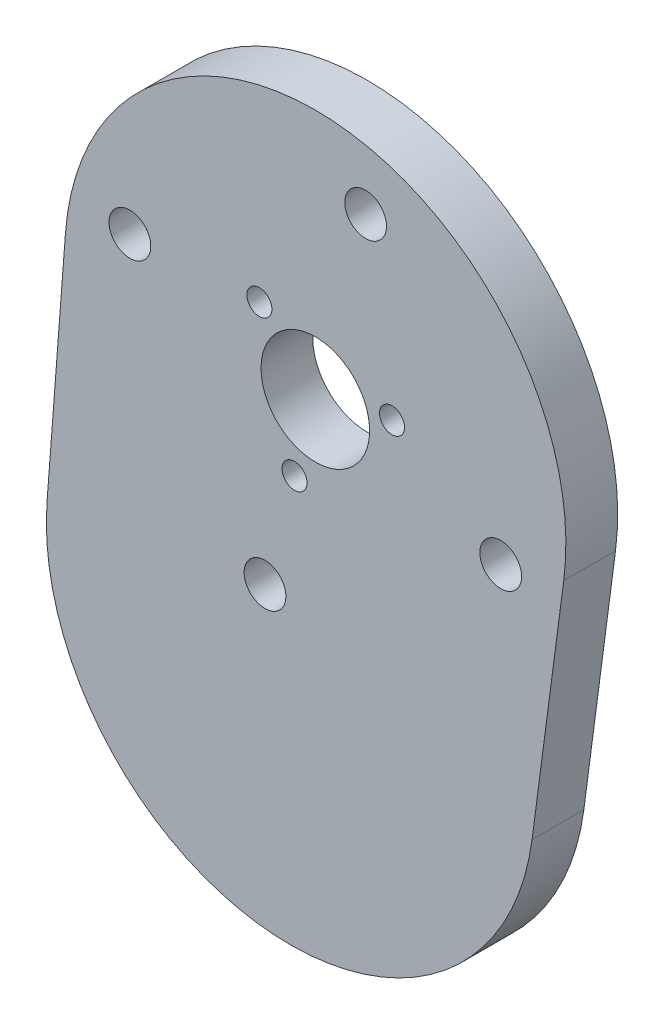
from build123d import *

# Parameters (mm, degrees)
SKETCH1_R           = 2.5
SKETCH1_R_2         = 6.5
BOSS_EXTRUDE1_DEPTH = 6.2
CUT_EXTRUDE1_REACH  = 68.667
SKETCH2_R           = 1.5


with BuildPart() as part:
    # Sketch1 → Boss-Extrude1 (new body)
    with BuildSketch(Plane.XY):
        with BuildLine():
            Line((25.948954725, -32.665145778), (29.742076772, -3.925413261))
            ThreePointArc((29.742076772, -3.925413261), (3.103448276, 29.839045038), (-29.913301505, 2.279121121))
            Line((-29.913301505, 2.279121121), (-32.115613465, -26.626065646))
            ThreePointArc((-32.115613465, -26.626065646), (-6.020689655, -57.887747374), (25.948954725, -32.665145778))
        make_face()
        with Locations(Location((22.196999252, -6.024385794, 0), (0, 0, 180))):
            Circle(SKETCH1_R, mode=Mode.SUBTRACT)
        with Locations(Location((-22.196999252, 6.024385794, 0), (0, 0, 180))):
            Circle(SKETCH1_R, mode=Mode.SUBTRACT)
        with Locations(Location((6.024385794, 22.196999252, 0), (0, 0, 180))):
            Circle(SKETCH1_R, mode=Mode.SUBTRACT)
        with Locations(Location((-6.024385794, -22.196999252, 0), (0, 0, 180))):
            Circle(SKETCH1_R, mode=Mode.SUBTRACT)
        with Locations(Location((0, 0, 0), (0, 0, 180))):
            Circle(SKETCH1_R_2, mode=Mode.SUBTRACT)
    extrude(amount=BOSS_EXTRUDE1_DEPTH)

    # Sketch2 → Cut-Extrude1 (cut, up to next)
    with BuildSketch(Plane.XY.offset(6.2), mode=Mode.PRIVATE) as cut_extrude1_sk1:
        with Locations((9.184169665, 2.42920307)):
            Circle(SKETCH2_R)
    cut_extrude1_tool1 = extrude(cut_extrude1_sk1.sketch, amount=-CUT_EXTRUDE1_REACH, mode=Mode.PRIVATE) & part.part
    # Sketch2 → Cut-Extrude1 (cut, up to next)
    with BuildSketch(Plane.XY.offset(6.2), mode=Mode.PRIVATE) as cut_extrude1_sk2:
        with Locations((-6.695836403, 6.739122708)):
            Circle(SKETCH2_R)
    cut_extrude1_tool2 = extrude(cut_extrude1_sk2.sketch, amount=-CUT_EXTRUDE1_REACH, mode=Mode.PRIVATE) & part.part
    # Sketch2 → Cut-Extrude1 (cut, up to next)
    with BuildSketch(Plane.XY.offset(6.2), mode=Mode.PRIVATE) as cut_extrude1_sk3:
        with Locations((-2.488333263, -9.168325778)):
            Circle(SKETCH2_R)
    cut_extrude1_tool3 = extrude(cut_extrude1_sk3.sketch, amount=-CUT_EXTRUDE1_REACH, mode=Mode.PRIVATE) & part.part
    add(cut_extrude1_tool1.solids().sort_by_distance((9.18417, 2.429203, 6.2))[0], mode=Mode.SUBTRACT)
    add(cut_extrude1_tool2.solids().sort_by_distance((-6.695836, 6.739123, 6.2))[0], mode=Mode.SUBTRACT)
    add(cut_extrude1_tool3.solids().sort_by_distance((-2.488333, -9.168326, 6.2))[0], mode=Mode.SUBTRACT)


solid = part.part
